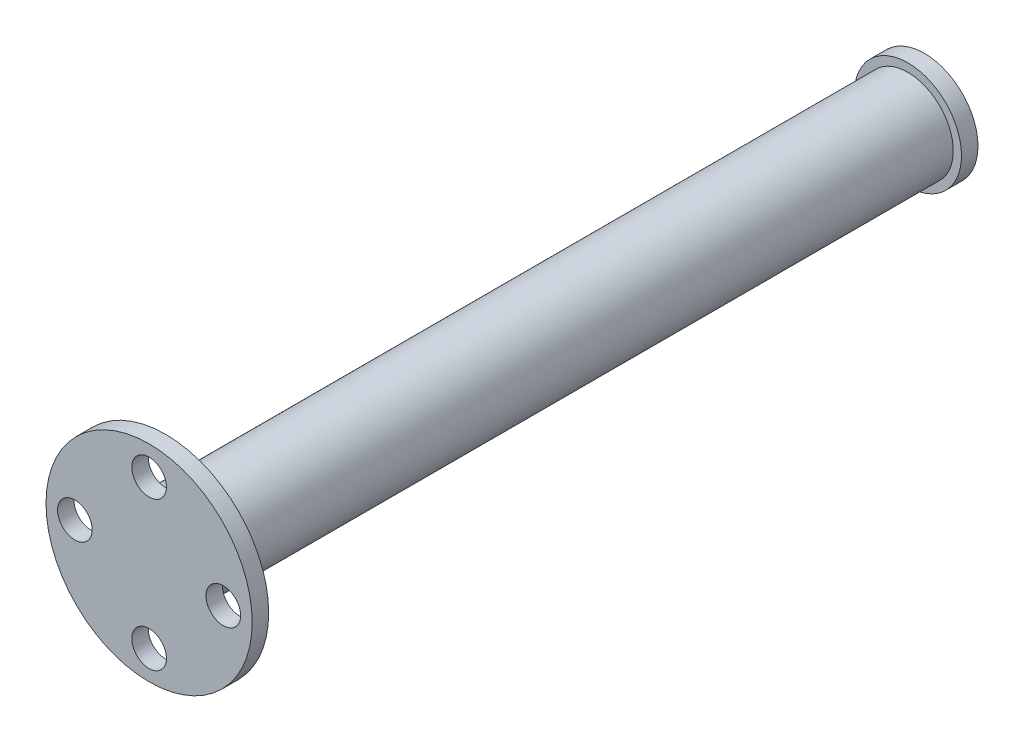
from build123d import *

# Parameters (mm, degrees)
SKETCH1_R           = 6.5
SKETCH1_R_2         = 2.5
BOSS_EXTRUDE1_DEPTH = 2
SKETCH2_R           = 5.5
SKETCH2_R_2         = 3.5
BOSS_EXTRUDE2_DEPTH = 90
BOSS_EXTRUDE3_START = -2
SKETCH4_R           = 3.5
BOSS_EXTRUDE3_DEPTH = 2
SKETCH5_R           = 12.5
BOSS_EXTRUDE4_DEPTH = 2
SKETCH6_R           = 2.1
CUT_EXTRUDE1_DEPTH  = 10


with BuildPart() as part:
    # Sketch1 → Boss-Extrude1 (new body)
    with BuildSketch(Plane.XY):
        Circle(SKETCH1_R)
        Circle(SKETCH1_R_2, mode=Mode.SUBTRACT)
    extrude(amount=BOSS_EXTRUDE1_DEPTH)

    # Sketch2 → Boss-Extrude2 (add)
    with BuildSketch(Plane.XY.offset(2)):
        with Locations(Location((0, 0, 0), (0, 0, 180))):
            Circle(SKETCH2_R)
        with Locations(Location((0, 0, 0), (0, 0, 180))):
            Circle(SKETCH2_R_2, mode=Mode.SUBTRACT)
    extrude(amount=BOSS_EXTRUDE2_DEPTH)

    # Sketch4 → Boss-Extrude3 (add)
    with BuildSketch(Plane.XY.offset(92).offset(BOSS_EXTRUDE3_START)):
        with Locations(Location((0, 0, 0), (0, 0, 180))):
            Circle(SKETCH4_R)
    extrude(amount=BOSS_EXTRUDE3_DEPTH)

    # Sketch5 → Boss-Extrude4 (add)
    with BuildSketch(Plane.XY.offset(92)):
        Circle(SKETCH5_R)
    extrude(amount=BOSS_EXTRUDE4_DEPTH)

    # Sketch6 → Cut-Extrude1 (cut)
    with BuildSketch(Plane(origin=(0, 0, 92), x_dir=(-1, 0, 0), z_dir=(0, 0, -1))):
        with Locations((0, 9)):
            Circle(SKETCH6_R)
        with Locations((9, 0)):
            Circle(SKETCH6_R)
        with Locations((0, -9)):
            Circle(SKETCH6_R)
        with Locations((-9, 0)):
            Circle(SKETCH6_R)
    extrude(amount=-CUT_EXTRUDE1_DEPTH, mode=Mode.SUBTRACT)


solid = part.part
